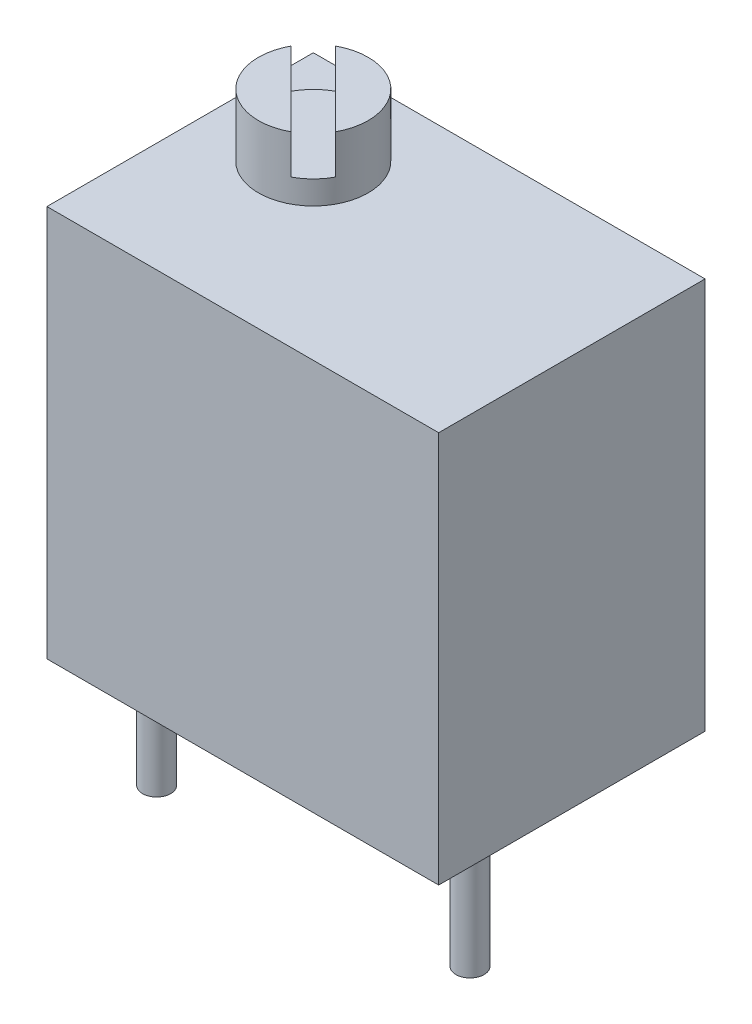
from build123d import *

# Parameters (mm, degrees)
SKETCH1_W      = 6.35
SKETCH1_H      = 4.318
EXTRUDE1_DEPTH = 6.35
SKETCH2_R      = 0.889
EXTRUDE2_DEPTH = 1.016
EXTRUDE3_DEPTH = 0.635
SKETCH4_R      = 0.2286
EXTRUDE4_DEPTH = 4.7752
SKETCH5_W      = 5.5372
SKETCH5_H      = 2.8702
PCB_TRIM_DEPTH = 11.204353189


with BuildPart() as part:
    # Sketch1 → Extrude1 (new body)
    with BuildSketch(Plane(origin=(0, 0, 0), x_dir=(1, 0, 0), z_dir=(0, 1, 0))):
        with Locations((2.413, 1.143)):
            Rectangle(SKETCH1_W, SKETCH1_H)
    extrude(amount=EXTRUDE1_DEPTH)

    # Sketch2 → Extrude2 (add)
    with BuildSketch(Plane(origin=(0, 6.35, 0), x_dir=(1, 0, 0), z_dir=(0, 1, 0))):
        with Locations(Location((0.762, 1.778, 0), (0, 0, 90))):
            Circle(SKETCH2_R)
    extrude(amount=EXTRUDE2_DEPTH)

    # Sketch3 → Extrude3 (cut)
    with BuildSketch(Plane(origin=(0, 7.366, 0), x_dir=(1, 0, 0), z_dir=(0, 1, 0))):
        Polygon((-0.145336371, 2.326126126), (1.310126126, 0.870663629), (1.669336371, 1.229873874), (0.213873874, 2.685336371), align=None)
    extrude(amount=-EXTRUDE3_DEPTH, mode=Mode.SUBTRACT)

    # Sketch4 → Extrude4 (add)
    with BuildSketch(Plane.XZ):
        with Locations(Location((0, 0, 0), (0, 0, 270))):
            Circle(SKETCH4_R)
        with Locations(Location((5.08, 0, 0), (0, 0, 270))):
            Circle(SKETCH4_R)
        with Locations(Location((2.54, -2.54, 0), (0, 0, 270))):
            Circle(SKETCH4_R)
    extrude(amount=EXTRUDE4_DEPTH)

    # Sketch5 → PCB Trim (cut, through all)
    with BuildSketch(Plane.XY.offset(1.016)):
        with Locations((2.54, -3.3401)):
            Rectangle(SKETCH5_W, SKETCH5_H)
    extrude(amount=-PCB_TRIM_DEPTH, mode=Mode.SUBTRACT)


solid = part.part
